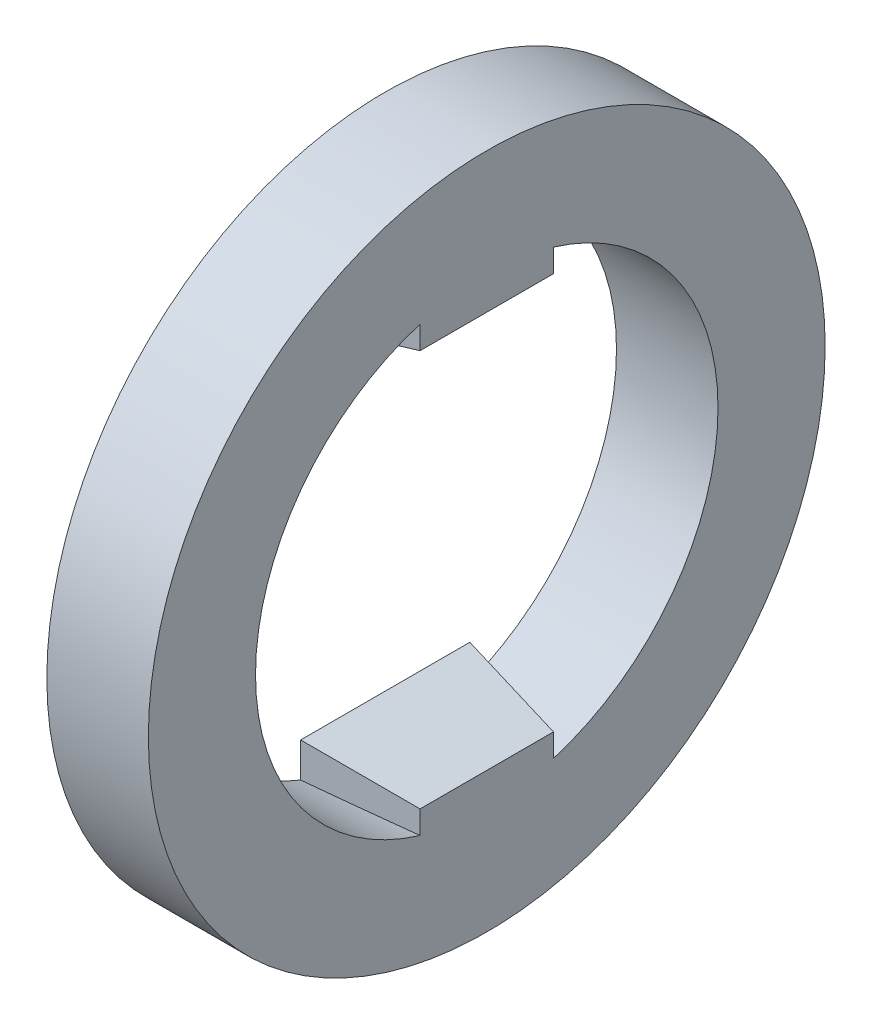
from build123d import *

# Parameters (mm, degrees)
SKETCH1_R                     = 6
SKETCH1_R_2                   = 4.1
BOSS_EXTRUDE1_DEPTH           = 0.9
BOSS_EXTRUDE2_START           = -0.9
BOSS_EXTRUDE2_DEPTH           = 1.8
BOSS_EXTRUDE2_DRAFT           = 10
BOSS_EXTRUDE2_PROFILE_2_DEPTH = 1.8
BOSS_EXTRUDE2_PROFILE_2_DRAFT = 10


with BuildPart() as part:
    # Sketch1 → Boss-Extrude1 (new, symmetric)
    with BuildSketch(Plane.YZ):
        with Locations(Location((0, 0, 0), (0, 0, 270))):
            Circle(SKETCH1_R)
        with Locations(Location((0, 0, 0), (0, 0, 270))):
            Circle(SKETCH1_R_2, mode=Mode.SUBTRACT)
    extrude(amount=BOSS_EXTRUDE1_DEPTH, both=True)


with BuildPart() as boss_extrude2_tool:
    # Sketch2 → Boss-Extrude2 (with draft: the straight prism first)
    with BuildSketch(Plane.YZ.offset(BOSS_EXTRUDE2_START)):
        with BuildLine():
            Line((5.809475019, 1.5), (3.2, 1.5))
            Line((3.2, 1.5), (3.2, -1.5))
            Line((3.2, -1.5), (5.809475019, -1.5))
            ThreePointArc((5.809475019, -1.5), (6, 0), (5.809475019, 1.5))
        make_face()
    extrude(amount=BOSS_EXTRUDE2_DEPTH)
    # Boss-Extrude2: the draft: its side faces are tilted about the plane it starts from
    boss_extrude2_sides = [boss_extrude2_tool.faces().sort_by_distance(p)[0] for p in [
        (0, 4.50473751, 1.5),
        (0, 3.2, 0),
        (0, 4.50473751, -1.5),
        (0, 6, 0),
    ]]
    draft(boss_extrude2_sides, Plane.YZ.offset(BOSS_EXTRUDE2_START), BOSS_EXTRUDE2_DRAFT)


with BuildPart() as part_1:
    add(part.part)

    # Boss-Extrude2: add boss_extrude2_tool
    add(boss_extrude2_tool.part)


with BuildPart() as boss_extrude2_profile_2_tool:
    # Sketch2 → Boss-Extrude2 profile 2 (with draft: the straight prism first)
    with BuildSketch(Plane.YZ.offset(BOSS_EXTRUDE2_START)):
        with BuildLine():
            ThreePointArc((-5.809475019, 1.5), (-6, 0), (-5.809475019, -1.5))
            Line((-5.809475019, -1.5), (-3.2, -1.5))
            Line((-3.2, -1.5), (-3.2, 1.5))
            Line((-3.2, 1.5), (-5.809475019, 1.5))
        make_face()
    extrude(amount=BOSS_EXTRUDE2_PROFILE_2_DEPTH)
    # Boss-Extrude2 profile 2: the draft: its side faces are tilted about the plane it starts from
    boss_extrude2_profile_2_sides = [boss_extrude2_profile_2_tool.faces().sort_by_distance(p)[0] for p in [
        (0, -6, 0),
        (0, -4.50473751, -1.5),
        (0, -3.2, 0),
        (0, -4.50473751, 1.5),
    ]]
    draft(boss_extrude2_profile_2_sides, Plane.YZ.offset(BOSS_EXTRUDE2_START), BOSS_EXTRUDE2_PROFILE_2_DRAFT)


with BuildPart() as part_2:
    add(part_1.part)

    # Boss-Extrude2 profile 2: add boss_extrude2_profile_2_tool
    add(boss_extrude2_profile_2_tool.part)


solid = part_2.part
